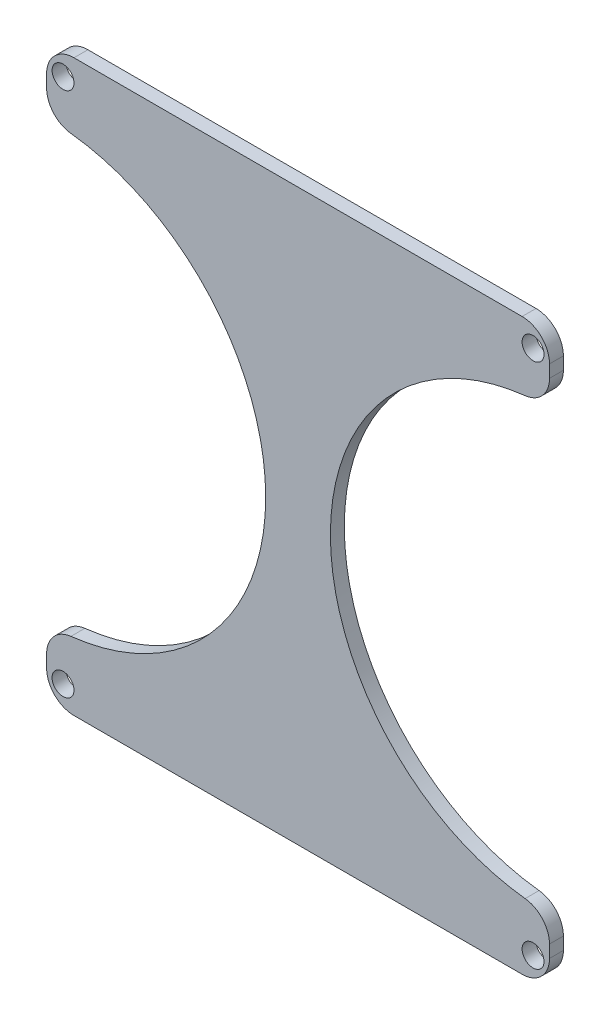
from build123d import *

# Parameters (mm, degrees)
SKETCH2_W           = 91.809324831
SKETCH2_H           = 104
BOSS_EXTRUDE1_DEPTH = 2.54
SKETCH1_R           = 2
CUT_EXTRUDE1_DEPTH  = 536.483262079
CUT_EXTRUDE2_DEPTH  = 10
FILLET1_R           = 5


with BuildPart() as part:
    # Sketch2 → Boss-Extrude1 (new body)
    with BuildSketch(Plane.XY):
        with Locations((-386.858920313, 263.359404222)):
            Rectangle(SKETCH2_W, SKETCH2_H)
    extrude(amount=BOSS_EXTRUDE1_DEPTH)

    # Sketch1 → Cut-Extrude1 (cut, through all)
    with BuildSketch(Plane.XY):
        with Locations((-343.954257897, 311.359404222)):
            Circle(SKETCH1_R)
        with Locations((-429.763582728, 311.359404222)):
            Circle(SKETCH1_R)
        with Locations((-429.763582728, 215.359404222)):
            Circle(SKETCH1_R)
        with Locations((-343.954257897, 215.359404222)):
            Circle(SKETCH1_R)
    extrude(amount=CUT_EXTRUDE1_DEPTH, mode=Mode.SUBTRACT)

    # Sketch3 → Cut-Extrude2 (cut)
    with BuildSketch(Plane(origin=(0, 0, 0), x_dir=(-1, 0, 0), z_dir=(0, 0, -1))):
        with BuildLine():
            Line((380.954257897, 263.359404222), (340.954257897, 263.359404222))
            Line((340.954257897, 263.359404222), (340.954257897, 223.359404222))
            ThreePointArc((340.954257897, 223.359404222), (369.238529145, 235.075132974), (380.954257897, 263.359404222))
        make_face()
        with BuildLine():
            Line((340.954257897, 303.359404222), (340.954257897, 263.359404222))
            Line((340.954257897, 263.359404222), (380.954257897, 263.359404222))
            ThreePointArc((380.954257897, 263.359404222), (369.238529145, 291.643675469), (340.954257897, 303.359404222))
        make_face()
        with BuildLine():
            ThreePointArc((432.763582728, 303.359404222), (404.47931148, 291.643675469), (392.763582728, 263.359404222))
            Line((392.763582728, 263.359404222), (432.763582728, 263.359404222))
            Line((432.763582728, 263.359404222), (432.763582728, 303.359404222))
        make_face()
        with BuildLine():
            Line((432.763582728, 263.359404222), (392.763582728, 263.359404222))
            ThreePointArc((392.763582728, 263.359404222), (404.47931148, 235.075132974), (432.763582728, 223.359404222))
            Line((432.763582728, 223.359404222), (432.763582728, 263.359404222))
        make_face()
    extrude(amount=-CUT_EXTRUDE2_DEPTH, mode=Mode.SUBTRACT)

    # Fillet1
    fillet1_edges = [part.edges().sort_by_distance(p)[0] for p in [
        (-340.954257897, 303.359404222, 1.27),
        (-340.954257897, 223.359404222, 1.27),
        (-432.763582728, 303.359404222, 1.27),
        (-432.763582728, 223.359404222, 1.27),
        (-432.763582728, 211.359404222, 1.27),
        (-340.954257897, 211.359404222, 1.27),
        (-340.954257897, 315.359404222, 1.27),
        (-432.763582728, 315.359404222, 1.27),
    ]]
    fillet(fillet1_edges, radius=FILLET1_R)


solid = part.part
